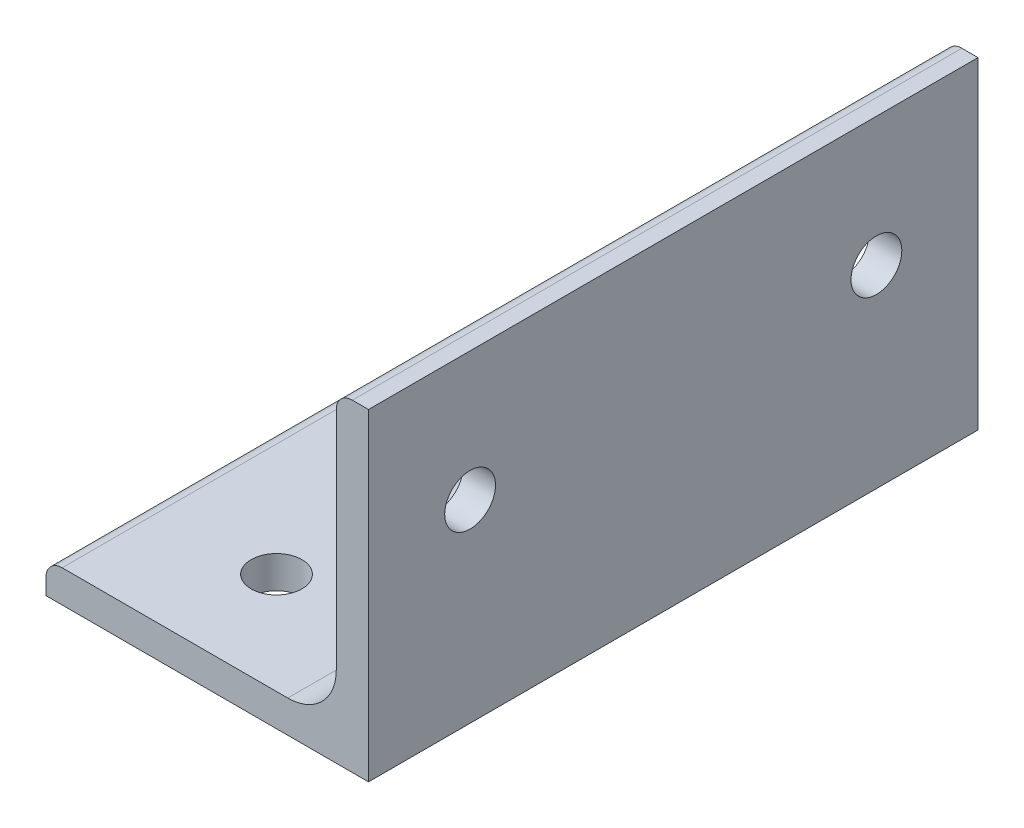
from build123d import *

# Parameters (mm, degrees)
BOSS_EXTRUDE1_DEPTH = 304.8
SKETCH3_W           = 34.414454966
SKETCH3_H           = 33.657940314
CUT_EXTRUDE1_DEPTH  = 549.6
SKETCH5_R           = 2.5
CUT_EXTRUDE2_DEPTH  = 101.6
SKETCH4_R           = 2.5
CUT_EXTRUDE3_DEPTH  = 101.6


with BuildPart() as part:
    # Sketch2 → Boss-Extrude1 (new, symmetric)
    with BuildSketch(Plane.XY):
        with BuildLine():
            Line((-15.875, -15.875), (15.875, -15.875))
            Line((15.875, -15.875), (15.875, 15.875))
            Line((15.875, 15.875), (14.2875, 15.875))
            ThreePointArc((14.2875, 15.875), (13.164967985, 15.410032015), (12.7, 14.2875))
            Line((12.7, 14.2875), (12.7, -7.9248))
            ThreePointArc((12.7, -7.9248), (11.301376302, -11.301376302), (7.9248, -12.7))
            Line((7.9248, -12.7), (-14.2875, -12.7))
            ThreePointArc((-14.2875, -12.7), (-15.410032015, -13.164967985), (-15.875, -14.2875))
            Line((-15.875, -14.2875), (-15.875, -15.875))
        make_face()
    extrude(amount=BOSS_EXTRUDE1_DEPTH, both=True)

    # Sketch3 → Cut-Extrude1 (cut)
    with BuildSketch(Plane(origin=(0, 0, -304.8), x_dir=(-1, 0, 0), z_dir=(0, 0, -1))):
        with Locations((1.332227483, 0.953970157)):
            Rectangle(SKETCH3_W, SKETCH3_H)
    extrude(amount=-CUT_EXTRUDE1_DEPTH, mode=Mode.SUBTRACT)

    # Sketch5 → Cut-Extrude2 (cut)
    with BuildSketch(Plane.ZY.offset(-12.7)):
        with Locations(Location((294.8, 3.18135, 0), (0, 0, 270))):
            Circle(SKETCH5_R)
        with Locations(Location((254.8, 3.18135, 0), (0, 0, 270))):
            Circle(SKETCH5_R)
    extrude(amount=-CUT_EXTRUDE2_DEPTH, mode=Mode.SUBTRACT)

    # Sketch4 → Cut-Extrude3 (cut)
    with BuildSketch(Plane(origin=(0, -12.7, 0), x_dir=(1, 0, 0), z_dir=(0, 1, 0))):
        with Locations(Location((-3.18135, -254.8, 0), (0, 0, 180))):
            Circle(SKETCH4_R)
        with Locations(Location((-3.18135, -294.8, 0), (0, 0, 180))):
            Circle(SKETCH4_R)
    extrude(amount=-CUT_EXTRUDE3_DEPTH, mode=Mode.SUBTRACT)


solid = part.part
